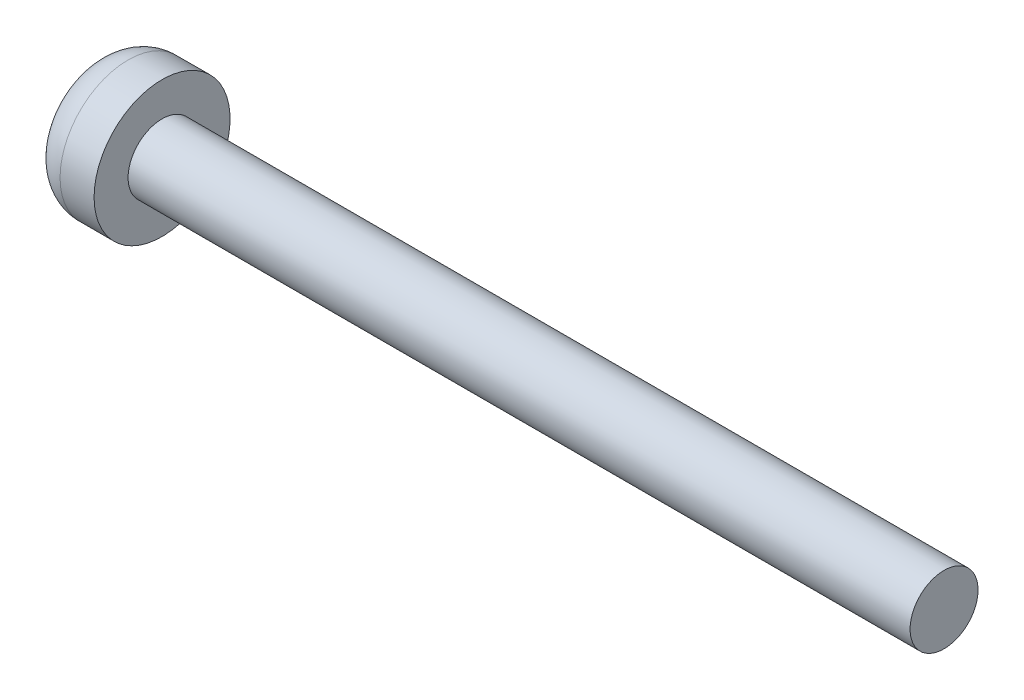
from build123d import *

# Parameters (mm, degrees)
FILLET1_R = 1


with BuildPart() as part:
    # Sketch1 → Revolve1 (revolve)
    with BuildSketch(Plane.XY):
        Polygon((0, 2), (0, 0), (25, 0), (25, 1), (2, 1), (2, 2), align=None)
    revolve(axis=Axis((0, 0, 0), (1, 0, 0)))

    # Fillet1
    fillet1_edges = [part.edges().sort_by_distance(p)[0] for p in [
        (0, -2, 0),
    ]]
    fillet(fillet1_edges, radius=FILLET1_R)


solid = part.part
